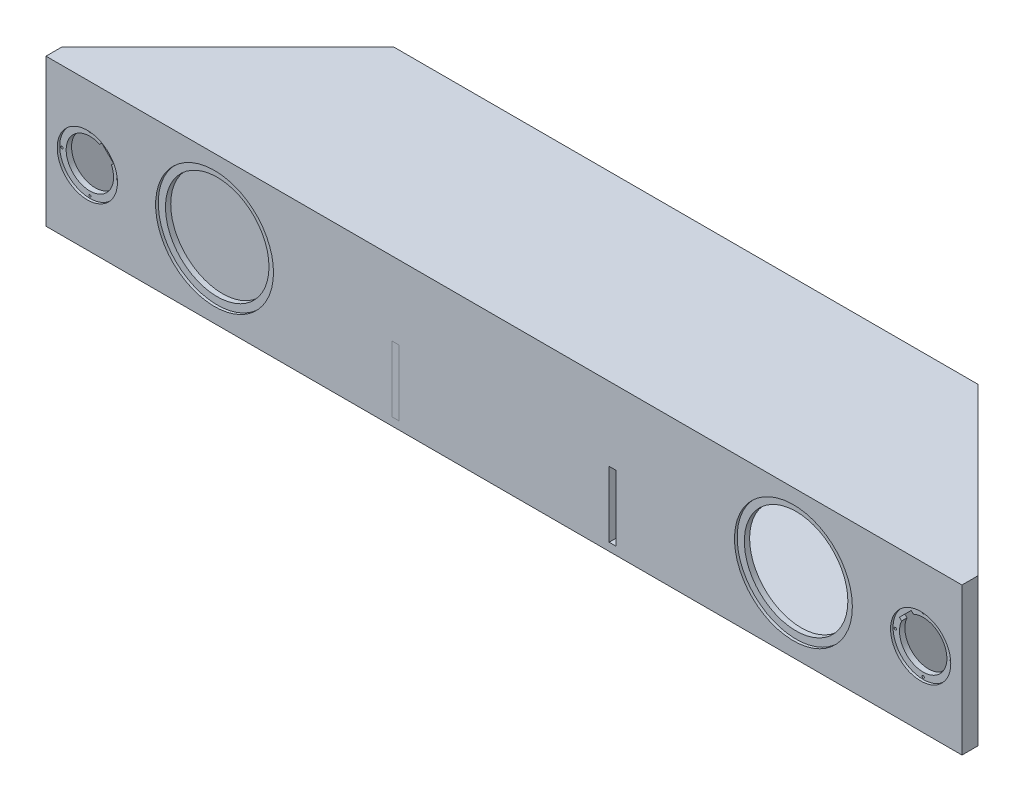
from build123d import *

# Parameters (mm, degrees)
SKETCH1_W                        = 1371.6
SKETCH1_H                        = 220.6244
BOSS_EXTRUDE1_DEPTH              = 272.2372
SKETCH3_W                        = 1347.8256
SKETCH3_H                        = 196.85
CUT_EXTRUDE2_DEPTH               = 260.35
SKETCH4_W                        = 11.8872
SKETCH4_H                        = 196.85
BOSS_EXTRUDE4_DEPTH              = 260.35
CUT_EXTRUDE3_DEPTH               = 771.136259982
CUT_EXTRUDE3_DEPTH_BACK          = 771.136259982
SKETCH5_W                        = 11.8872
SKETCH5_H                        = 196.85
INTERNAL_BRACING_DEPTH           = 260.35
SKETCH2_R                        = 77.5
SKETCH2_R_2                      = 45.1
CUT_EXTRUDE1_DEPTH               = 14
BOSS_EXTRUDE2_START              = -3.8
SKETCH128_R                      = 45.1
SKETCH128_R_2                    = 35.5
BOSS_EXTRUDE2_DEPTH              = 8.0872
CUT_EXTRUDE4_REACH               = 746.68
M4X0_7_TAPPED_HOLE1_D            = 3.3
SKETCH193_R                      = 88.25
CUT_EXTRUDE6_DEPTH               = 4
BOSS_EXTRUDE7_DEPTH              = 220.6244
BOSS_EXTRUDE11_REACH             = 768.815
BOSS_EXTRUDE11_DIRECTION_2_REACH = 768.815
SKETCH198_W                      = 11.8872
SKETCH198_H                      = 10.16002032
SKETCH198_W_2                    = 10.16002032
SKETCH198_H_2                    = 11.8872
CUT_EXTRUDE7_DEPTH               = 98.425
BOSS_EXTRUDE12_DEPTH             = 98.425
BOSS_EXTRUDE13_REACH             = 768.815


with BuildPart() as part:
    # Sketch1 → Boss-Extrude1 (new body)
    with BuildSketch(Plane.XY):
        Rectangle(SKETCH1_W, SKETCH1_H)
    extrude(amount=-BOSS_EXTRUDE1_DEPTH)

    # Sketch3 → Cut-Extrude2 (cut)
    with BuildSketch(Plane(origin=(0, 0, -272.2372), x_dir=(-1, 0, 0), z_dir=(0, 0, -1))):
        Rectangle(SKETCH3_W, SKETCH3_H)
    extrude(amount=-CUT_EXTRUDE2_DEPTH, mode=Mode.SUBTRACT)

    # Sketch4 → Boss-Extrude4 (add)
    with BuildSketch(Plane(origin=(0, 0, -11.8872), x_dir=(-1, 0, 0), z_dir=(0, 0, -1))):
        with Locations((-567.9692, 0)):
            Rectangle(SKETCH4_W, SKETCH4_H)
        with Locations((567.9692, 0)):
            Rectangle(SKETCH4_W, SKETCH4_H)
    extrude(amount=BOSS_EXTRUDE4_DEPTH)

    # Sketch23 → Cut-Extrude3 (cut, two sides: drawn at the far end of the back side and taken through both)
    with BuildSketch(Plane(origin=(0, 110.3122, 0), x_dir=(1, 0, 0), z_dir=(0, 1, 0)).offset(-CUT_EXTRUDE3_DEPTH_BACK)):
        Polygon((-685.8, 24), (-437.5628, 272.2372), (-685.8, 272.2372), align=None)
        Polygon((685.8, 272.2372), (685.8, 24), (437.5628, 272.2372), align=None)
    extrude(amount=CUT_EXTRUDE3_DEPTH + CUT_EXTRUDE3_DEPTH_BACK, mode=Mode.SUBTRACT)

    # Sketch5 → INTERNAL BRACING (add)
    with BuildSketch(Plane(origin=(0, 0, -11.8872), x_dir=(-1, 0, 0), z_dir=(0, 0, -1))):
        with Locations((173.582, 0)):
            Rectangle(SKETCH5_W, SKETCH5_H)
        with Locations((-173.582, 0)):
            Rectangle(SKETCH5_W, SKETCH5_H)
        Rectangle(SKETCH5_W, SKETCH5_H)
    extrude(amount=INTERNAL_BRACING_DEPTH)

    # Sketch2 → Cut-Extrude1 (cut)
    with BuildSketch(Plane.XY):
        with Locations((433.4128, 0)):
            Circle(SKETCH2_R)
        with Locations((623.9128, 0)):
            Circle(SKETCH2_R_2)
        with Locations((-433.4128, 0)):
            Circle(SKETCH2_R)
        with Locations((-623.9128, 0)):
            Circle(SKETCH2_R_2)
    extrude(amount=-CUT_EXTRUDE1_DEPTH, mode=Mode.SUBTRACT)

    # Sketch128 → Boss-Extrude2 (add)
    # profile 1 of 2: a face of its own
    with BuildSketch(Plane.XY.offset(BOSS_EXTRUDE2_START)):
        with Locations((623.9128, 0)):
            Circle(SKETCH128_R)
        with Locations((623.9128, 0)):
            Circle(SKETCH128_R_2, mode=Mode.SUBTRACT)
    # profile 2 of 2: a face of its own
    with BuildSketch(Plane.XY.offset(BOSS_EXTRUDE2_START)):
        with Locations((-623.9128, 0)):
            Circle(SKETCH128_R)
        with Locations((-623.9128, 0)):
            Circle(SKETCH128_R_2, mode=Mode.SUBTRACT)
    extrude(amount=-BOSS_EXTRUDE2_DEPTH)

    # Sketch129 → Cut-Extrude4 (cut, up to next)
    with BuildSketch(Plane.XY.offset(-3.8), mode=Mode.PRIVATE) as cut_extrude4_sk1:
        Polygon((-588.36406402, 17.87106645), (-606.04173355, 35.54873598), (-609.256954516, 32.333515014), (-591.579284986, 14.655845484), align=None)
    cut_extrude4_tool1 = extrude(cut_extrude4_sk1.sketch, amount=-CUT_EXTRUDE4_REACH, mode=Mode.PRIVATE) & part.part
    # Sketch129 → Cut-Extrude4 (cut, up to next)
    with BuildSketch(Plane.XY.offset(-3.8), mode=Mode.PRIVATE) as cut_extrude4_sk2:
        Polygon((591.579284986, 14.655845484), (609.256954516, 32.333515014), (606.04173355, 35.54873598), (588.36406402, 17.87106645), align=None)
    cut_extrude4_tool2 = extrude(cut_extrude4_sk2.sketch, amount=-CUT_EXTRUDE4_REACH, mode=Mode.PRIVATE) & part.part
    add(cut_extrude4_tool1.solids().sort_by_distance((-598.810509, 25.102291, -3.8))[0], mode=Mode.SUBTRACT)
    add(cut_extrude4_tool2.solids().sort_by_distance((598.810509, 25.102291, -3.8))[0], mode=Mode.SUBTRACT)

    # M4x0.7 Tapped Hole1 (through all)
    with Locations(Plane.XY.offset(-3.8)):
        with Locations((665.6628, 0), (-665.6628, 0), (-623.9128, 41.75), (-582.1628, 0), (-623.9128, -41.75), (623.9128, -41.75), (582.1628, 0), (623.9128, 41.75)):
            Hole(M4X0_7_TAPPED_HOLE1_D / 2)

    # Sketch193 → Cut-Extrude6 (cut)
    with BuildSketch(Plane.XY):
        with Locations((-433.4128, 0)):
            Circle(SKETCH193_R)
        with Locations((433.4128, 0)):
            Circle(SKETCH193_R)
    extrude(amount=-CUT_EXTRUDE6_DEPTH, mode=Mode.SUBTRACT)

    # Sketch196 → Boss-Extrude7 (add)
    with BuildSketch(Plane(origin=(0, 110.3122, 0), x_dir=(1, 0, 0), z_dir=(0, 1, 0))):
        Polygon((-432.638960541, 260.35), (-685.8, 7.188960541), (-685.8, 24), (-437.5628, 272.2372), (-167.6384, 272.2372), (-167.6384, 260.35), align=None)
        Polygon((685.8, 7.188960541), (432.638960541, 260.35), (167.6384, 260.35), (167.6384, 272.2372), (437.5628, 272.2372), (685.8, 24), align=None)
    extrude(amount=-BOSS_EXTRUDE7_DEPTH)

    # Sketch197 → Boss-Extrude11 (add, up to next)
    with BuildSketch(Plane(origin=(0, -98.425, 0), x_dir=(1, 0, 0), z_dir=(0, 1, 0)), mode=Mode.PRIVATE) as boss_extrude11_sk1:
        Polygon((-145.59117968, 11.8872), (-145.59117968, 272.2372), (-167.6384, 272.2372), (-167.6384, 260.35), (-157.47837968, 260.35), (-157.47837968, 11.8872), align=None)
    boss_extrude11_tool1 = extrude(boss_extrude11_sk1.sketch, amount=BOSS_EXTRUDE11_REACH, mode=Mode.PRIVATE) - part.part
    boss_extrude11 = boss_extrude11_tool1.solids().sort_by_distance((-151.948813, -98.425, -146.728177))[0]
    add(boss_extrude11)

    # Boss-Extrude11 direction 2: up to this face of the body (flat: up to its plane)
    boss_extrude11_direction_2_end = Plane(part.part.faces().sort_by_distance((0, -110.3122, -125.569689055))[0])
    # Sketch197 → Boss-Extrude11 direction 2 (add, up to the picked face)
    with BuildSketch(Plane(origin=(0, -98.425, 0), x_dir=(1, 0, 0), z_dir=(0, 1, 0)), mode=Mode.PRIVATE) as boss_extrude11_direction_2_sk1:
        Polygon((-145.59117968, 11.8872), (-145.59117968, 272.2372), (-167.6384, 272.2372), (-167.6384, 260.35), (-157.47837968, 260.35), (-157.47837968, 11.8872), align=None)
    boss_extrude11_direction_2_tool1 = split(extrude(boss_extrude11_direction_2_sk1.sketch, amount=-BOSS_EXTRUDE11_DIRECTION_2_REACH, mode=Mode.PRIVATE), bisect_by=boss_extrude11_direction_2_end, keep=Keep.BOTH, mode=Mode.PRIVATE)
    boss_extrude11_direction_2 = boss_extrude11_direction_2_tool1.solids().sort_by(Axis((-151.948813, -98.425, -146.728177), (0, -1, 0)))[0]
    add(boss_extrude11_direction_2)

    # Sketch198 → Cut-Extrude7 (cut)
    with BuildSketch(Plane(origin=(0, -98.425, 0), x_dir=(1, 0, 0), z_dir=(0, 1, 0))):
        with Locations((-173.582, 255.26998984)):
            Rectangle(SKETCH198_W, SKETCH198_H)
        with Locations((-162.55838984, 5.9436)):
            Rectangle(SKETCH198_W_2, SKETCH198_H_2)
    cut_extrude7 = extrude(amount=CUT_EXTRUDE7_DEPTH, mode=Mode.SUBTRACT)

    # Mirror1: Boss-Extrude11, Boss-Extrude11 direction 2, Cut-Extrude7 across plane
    add(boss_extrude11.mirror(Plane(origin=(0, 0, 0), x_dir=(0, 0, 1), z_dir=(1, 0, 0))))
    add(boss_extrude11_direction_2.mirror(Plane(origin=(0, 0, 0), x_dir=(0, 0, 1), z_dir=(1, 0, 0))))
    add(cut_extrude7.mirror(Plane(origin=(0, 0, 0), x_dir=(0, 0, 1), z_dir=(1, 0, 0))), mode=Mode.SUBTRACT)


with BuildPart() as body_2:
    # Sketch199 → Boss-Extrude12 (new body)
    with BuildSketch(Plane(origin=(0, -98.425, 0), x_dir=(1, 0, 0), z_dir=(0, 1, 0))):
        Polygon((-179.5256, 250.18997968), (-179.5256, 260.35), (-157.47837968, 260.35), (-157.47837968, 0), (-167.6384, 0), (-167.6384, 250.18997968), align=None)
    extrude(amount=BOSS_EXTRUDE12_DEPTH)


with BuildPart() as body_3:

    # Sketch200 → Boss-Extrude13 (new, up to next)
    with BuildSketch(Plane(origin=(0, -98.425, 0), x_dir=(1, 0, 0), z_dir=(0, 1, 0)), mode=Mode.PRIVATE) as boss_extrude13_sk1:
        Polygon((-179.5256, 11.8872), (-179.5256, 260.35), (-432.638960541, 260.35), (-562.0256, 130.963360541), (-562.0256, 11.8872), align=None)
    boss_extrude13_tool1 = extrude(boss_extrude13_sk1.sketch, amount=BOSS_EXTRUDE13_REACH, mode=Mode.PRIVATE) - part.part
    add(boss_extrude13_tool1.solids().sort_by_distance((-356.469731, -98.425, -128.285537))[0])


solid = Compound([part.part, body_2.part, body_3.part])
